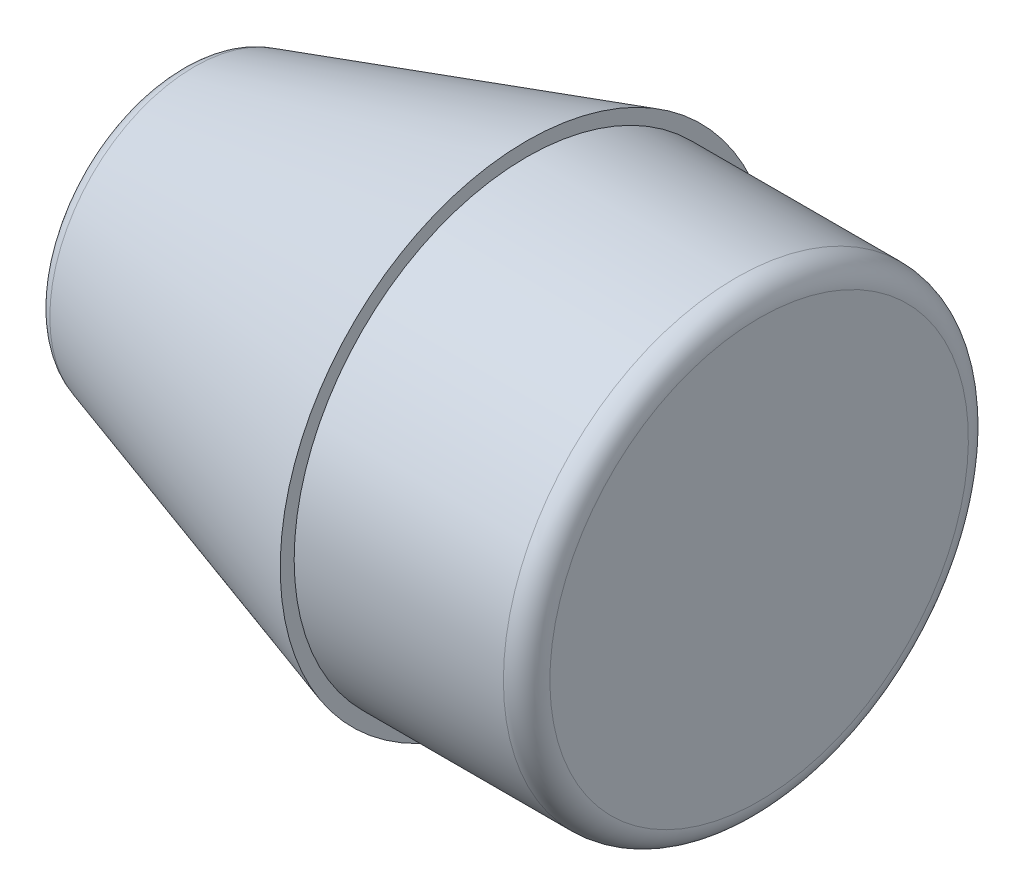
from build123d import *

# Parameters (mm, degrees)
FILETE1_R = 0.5
FILETE2_R = 0.5


with BuildPart() as part:
    # Esboço1 → Revolução1 (revolve)
    with BuildSketch(Plane.XY):
        Polygon((0, 0), (0, 3), (7.5, 5.3), (7.5, 5), (12.5, 5), (12.5, 0), align=None)
    revolve(axis=Axis((12.5, 0, 0), (-1, 0, 0)))

    # Filete1
    filete1_edges = [part.edges().sort_by_distance(p)[0] for p in [
        (12.5, -5, 0),
    ]]
    fillet(filete1_edges, radius=FILETE1_R)

    # Filete2
    filete2_edges = [part.edges().sort_by_distance(p)[0] for p in [
        (0, -3, 0),
    ]]
    fillet(filete2_edges, radius=FILETE2_R)


solid = part.part
